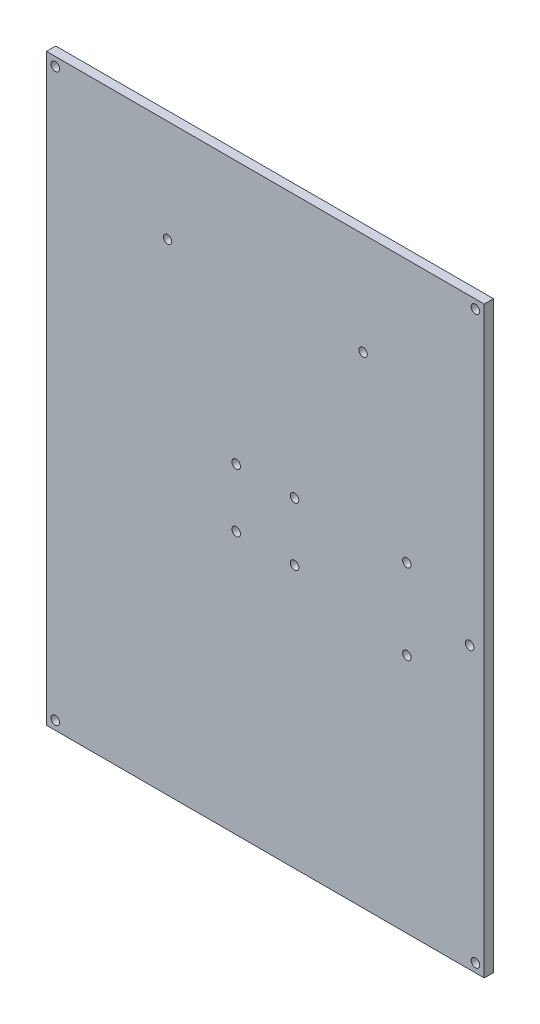
from build123d import *

# Parameters (mm, degrees)
SKETCH1_W               = 150
SKETCH1_H               = 200
BOSS_EXTRUDE1_DEPTH     = 3.18
SKETCH4_R               = 1.47
CUT_EXTRUDE2_DEPTH      = 10
MIRROR4_COPY_1_SKETCH_R = 1.47
MIRROR4_COPY_1_DEPTH    = 10
MIRROR4_COPY_2_SKETCH_R = 1.47
MIRROR4_COPY_2_DEPTH    = 10
SKETCH5_R               = 1.47
CUT_EXTRUDE3_DEPTH      = 3.18
MIRROR6_COPY_1_SKETCH_R = 1.47
MIRROR6_COPY_1_DEPTH    = 3.18
MIRROR6_COPY_2_SKETCH_R = 1.47
MIRROR6_COPY_2_DEPTH    = 3.18
SKETCH6_R               = 1.425
CUT_EXTRUDE5_DEPTH      = 3.18
SKETCH7_R               = 1.47
CUT_EXTRUDE6_DEPTH      = 3.18


with BuildPart() as part:
    # Sketch1 → Boss-Extrude1 (new body)
    with BuildSketch(Plane.XY):
        Rectangle(SKETCH1_W, SKETCH1_H)
    extrude(amount=BOSS_EXTRUDE1_DEPTH)

    # Sketch4 → Cut-Extrude2 (cut)
    with BuildSketch(Plane.XY.offset(3.18)):
        with Locations((10, -10)):
            Circle(SKETCH4_R)
    cut_extrude2 = extrude(amount=-CUT_EXTRUDE2_DEPTH, mode=Mode.SUBTRACT)

    # Mirror3: Cut-Extrude2 across plane
    add(cut_extrude2.mirror(Plane(origin=(0, 0, 0), x_dir=(0, 0, 1), z_dir=(1, 0, 0))), mode=Mode.SUBTRACT)

    # Mirror4 copy 1 sketch → Mirror4 copy 1 (cut)
    with BuildSketch(Plane(origin=(0, 0, 3.18), x_dir=(-1, 0, 0), z_dir=(0, 0, 1))):
        with Locations((10, -10)):
            Circle(MIRROR4_COPY_1_SKETCH_R)
    extrude(amount=-MIRROR4_COPY_1_DEPTH, mode=Mode.SUBTRACT)

    # Mirror4 copy 2 sketch → Mirror4 copy 2 (cut)
    with BuildSketch(Plane.XY.offset(3.18)):
        with Locations((10, 10)):
            Circle(MIRROR4_COPY_2_SKETCH_R)
    extrude(amount=-MIRROR4_COPY_2_DEPTH, mode=Mode.SUBTRACT)

    # Sketch5 → Cut-Extrude3 (cut)
    with BuildSketch(Plane.XY.offset(3.18)):
        with Locations((-72, -97)):
            Circle(SKETCH5_R)
    cut_extrude3 = extrude(amount=-CUT_EXTRUDE3_DEPTH, mode=Mode.SUBTRACT)

    # Mirror5: Cut-Extrude3 across plane
    add(cut_extrude3.mirror(Plane(origin=(0, 0, 0), x_dir=(0, 0, 1), z_dir=(1, 0, 0))), mode=Mode.SUBTRACT)

    # Mirror6 copy 1 sketch → Mirror6 copy 1 (cut)
    with BuildSketch(Plane(origin=(0, 0, 3.18), x_dir=(-1, 0, 0), z_dir=(0, 0, 1))):
        with Locations((-72, -97)):
            Circle(MIRROR6_COPY_1_SKETCH_R)
    extrude(amount=-MIRROR6_COPY_1_DEPTH, mode=Mode.SUBTRACT)

    # Mirror6 copy 2 sketch → Mirror6 copy 2 (cut)
    with BuildSketch(Plane.XY.offset(3.18)):
        with Locations((-72, 97)):
            Circle(MIRROR6_COPY_2_SKETCH_R)
    extrude(amount=-MIRROR6_COPY_2_DEPTH, mode=Mode.SUBTRACT)

    # Sketch6 → Cut-Extrude5 (cut)
    with BuildSketch(Plane.XY.offset(3.18)):
        with Locations((33.5, 65)):
            Circle(SKETCH6_R)
        with Locations((-33.5, 65)):
            Circle(SKETCH6_R)
    extrude(amount=-CUT_EXTRUDE5_DEPTH, mode=Mode.SUBTRACT)

    # Sketch7 → Cut-Extrude6 (cut)
    with BuildSketch(Plane.XY.offset(3.18)):
        with Locations((70, -3.75)):
            Circle(SKETCH7_R)
        with Locations((48.5, 10)):
            Circle(SKETCH7_R)
        with Locations((48.5, -17.5)):
            Circle(SKETCH7_R)
    extrude(amount=-CUT_EXTRUDE6_DEPTH, mode=Mode.SUBTRACT)


solid = part.part
